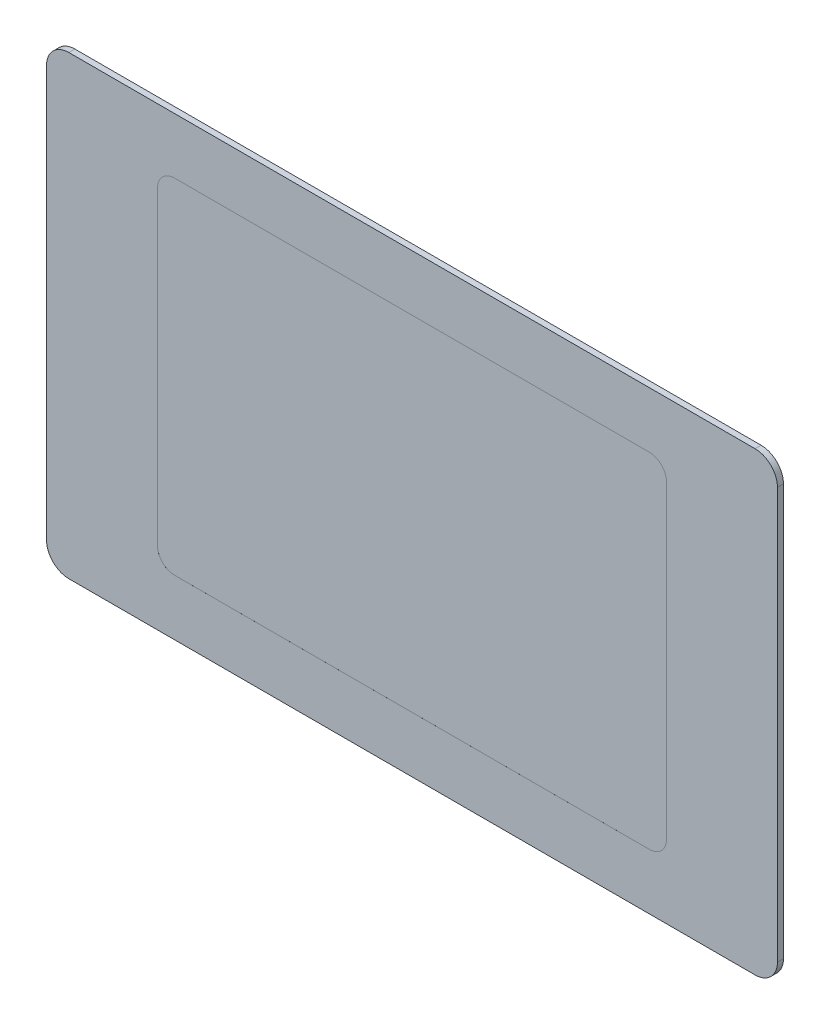
from build123d import *

# Parameters (mm, degrees)
EXTRUDE_1_DEPTH = 0.7
EXTRUDE_2_DEPTH = 0.001


with BuildPart() as part:
    # Эскиз1 → Бобышка-Вытянуть1 (new body)
    with BuildSketch(Plane.XY):
        with BuildLine():
            Line((-39.9, 26.5), (39.9, 26.5))
            ThreePointArc((39.9, 26.5), (41.738477631, 25.738477631), (42.5, 23.9))
            Line((42.5, 23.9), (42.5, -23.9))
            ThreePointArc((42.5, -23.9), (41.738477631, -25.738477631), (39.9, -26.5))
            Line((39.9, -26.5), (-39.9, -26.5))
            ThreePointArc((-39.9, -26.5), (-41.738477631, -25.738477631), (-42.5, -23.9))
            Line((-42.5, -23.9), (-42.5, 23.9))
            ThreePointArc((-42.5, 23.9), (-41.738477631, 25.738477631), (-39.9, 26.5))
        make_face()
    extrude(amount=EXTRUDE_1_DEPTH)

    # Эскиз2 → Бобышка-Вытянуть2 (add)
    with BuildSketch(Plane.XY.offset(0.7)):
        with BuildLine():
            Line((-42.5, -23.9), (-42.5, 23.9))
            ThreePointArc((-42.5, 23.9), (-41.738477631, 25.738477631), (-39.9, 26.5))
            Line((-39.9, 26.5), (39.9, 26.5))
            ThreePointArc((39.9, 26.5), (41.738477631, 25.738477631), (42.5, 23.9))
            Line((42.5, 23.9), (42.5, -23.9))
            ThreePointArc((42.5, -23.9), (41.738477631, -25.738477631), (39.9, -26.5))
            Line((39.9, -26.5), (-39.9, -26.5))
            ThreePointArc((-39.9, -26.5), (-41.738477631, -25.738477631), (-42.5, -23.9))
        make_face()
        with BuildLine():
            Line((-27.6, 20), (27.6, 20))
            ThreePointArc((27.6, 20), (29.014213562, 19.414213562), (29.6, 18))
            Line((29.6, 18), (29.6, -18))
            ThreePointArc((29.6, -18), (29.014213562, -19.414213562), (27.6, -20))
            Line((27.6, -20), (-27.6, -20))
            ThreePointArc((-27.6, -20), (-29.014213562, -19.414213562), (-29.6, -18))
            Line((-29.6, -18), (-29.6, 18))
            ThreePointArc((-29.6, 18), (-29.014213562, 19.414213562), (-27.6, 20))
        make_face(mode=Mode.SUBTRACT)
    extrude(amount=EXTRUDE_2_DEPTH)


solid = part.part
